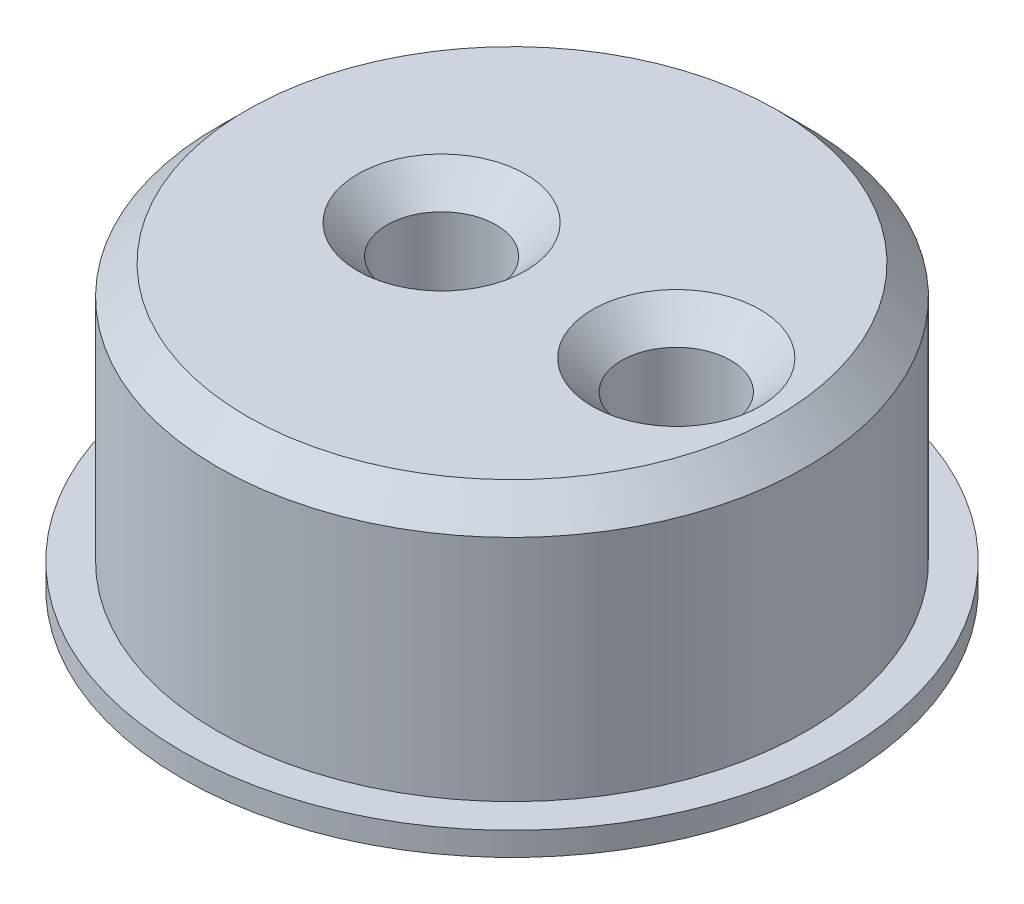
from build123d import *

# Parameters (mm, degrees)
SKETCH_1_R      = 5.02
SKETCH_1_R_2    = 0.93
EXTRUDE_1_DEPTH = 4.4
EXTRUDE_START   = 0.4
SKETCH_3_R      = 5.62
SKETCH_3_R_2    = 0.93
EXTRUDE_2_DEPTH = 0.4
CHAMFER_1_SIZE  = 0.5


with BuildPart() as part:
    # 草图1 → 凸台-拉伸1 (new body)
    with BuildSketch(Plane(origin=(0, 0, 0), x_dir=(1, 0, 0), z_dir=(0, 1, 0))):
        Circle(SKETCH_1_R)
        with Locations((2.8, 0)):
            Circle(SKETCH_1_R_2, mode=Mode.SUBTRACT)
        with Locations((-1.2, 0)):
            Circle(SKETCH_1_R_2, mode=Mode.SUBTRACT)
    extrude(amount=EXTRUDE_1_DEPTH)

    # 草图3 → 凸台-拉伸2 (add)
    with BuildSketch(Plane.XZ.offset(EXTRUDE_START)):
        Circle(SKETCH_3_R)
        with Locations((2.8, 0)):
            Circle(SKETCH_3_R_2, mode=Mode.SUBTRACT)
        with Locations((-1.2, 0)):
            Circle(SKETCH_3_R_2, mode=Mode.SUBTRACT)
    extrude(amount=-EXTRUDE_2_DEPTH)

    # 倒角1
    chamfer_1_edges = [part.edges().sort_by_distance(p)[0] for p in [
        (-5.02, 4.4, 0),
        (-2.13, 4.4, 0),
        (1.87, 4.4, 0),
        (-2.13, -0.4, 0),
        (1.87, -0.4, 0),
    ]]
    chamfer(chamfer_1_edges, length=CHAMFER_1_SIZE)


solid = part.part
